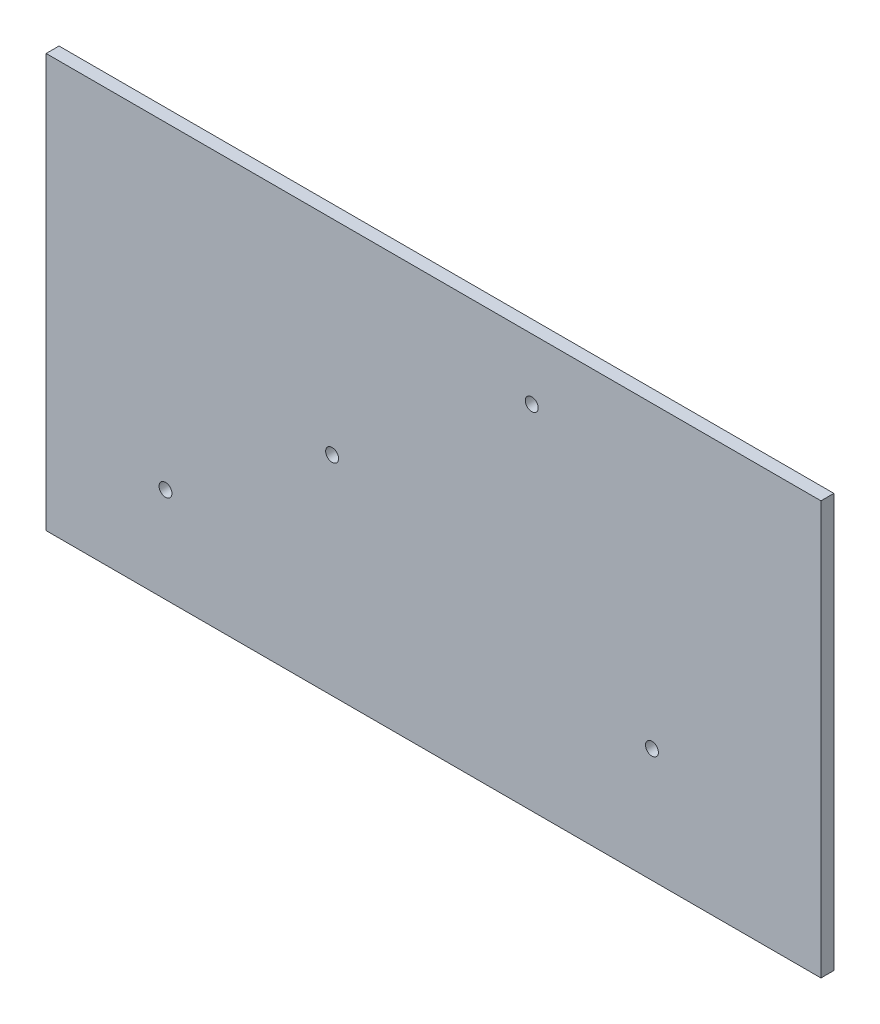
from build123d import *

# Parameters (mm, degrees)
SKETCH1_W           = 600
SKETCH1_H           = 320
SKETCH1_R           = 5
BOSS_EXTRUDE1_DEPTH = 10


with BuildPart() as part:
    # Sketch1 → Boss-Extrude1 (new body)
    with BuildSketch(Plane.XY):
        with Locations((300, 160)):
            Rectangle(SKETCH1_W, SKETCH1_H)
        with Locations((221.459837978, 161.505190603)):
            Circle(SKETCH1_R, mode=Mode.SUBTRACT)
        with Locations((92.436469666, 73.613432994)):
            Circle(SKETCH1_R, mode=Mode.SUBTRACT)
        with Locations((376.028101358, 272.777021664)):
            Circle(SKETCH1_R, mode=Mode.SUBTRACT)
        with Locations((469.115430845, 88.334219983)):
            Circle(SKETCH1_R, mode=Mode.SUBTRACT)
    extrude(amount=BOSS_EXTRUDE1_DEPTH)


solid = part.part
